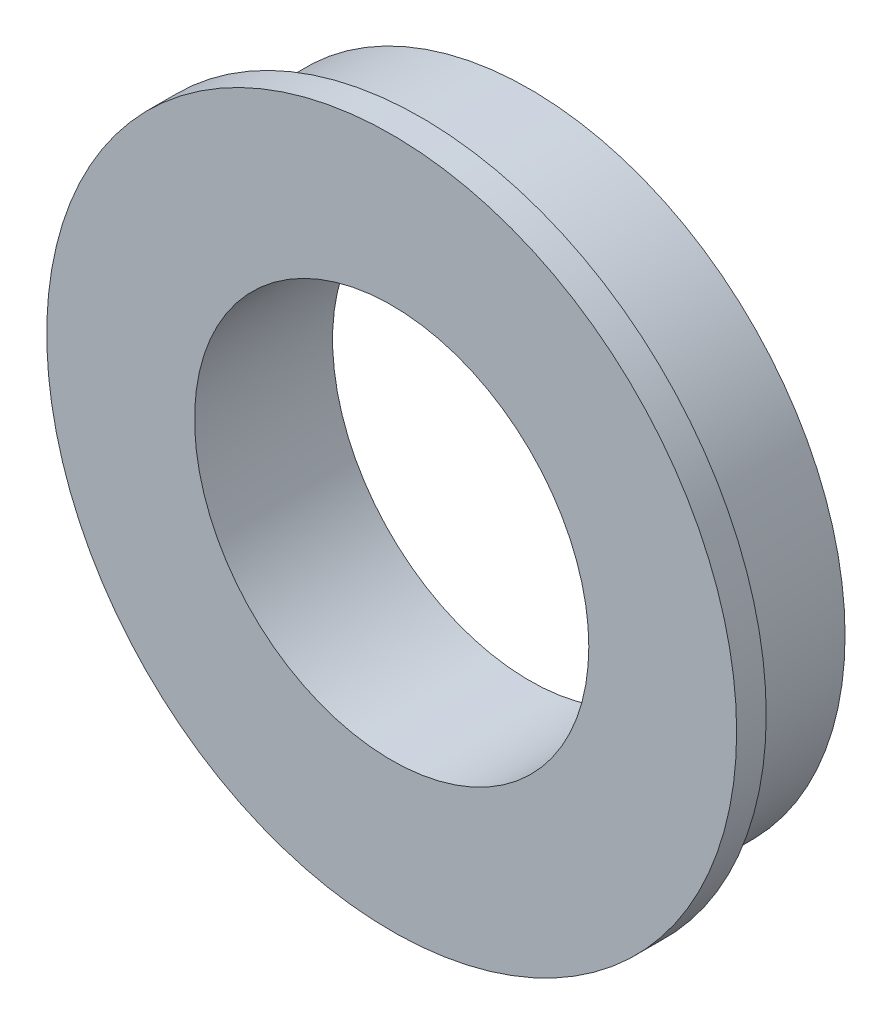
from build123d import *

# Parameters (mm, degrees)
SKETCH_1_R      = 16
SKETCH_1_R_2    = 10
EXTRUDE_1_DEPTH = 5.5
SKETCH_2_R      = 17.5
SKETCH_2_R_2    = 10
EXTRUDE_2_DEPTH = 1.5


with BuildPart() as part:
    # 草图1 → 凸台-拉伸1 (new body)
    with BuildSketch(Plane.XY):
        Circle(SKETCH_1_R)
        Circle(SKETCH_1_R_2, mode=Mode.SUBTRACT)
    extrude(amount=EXTRUDE_1_DEPTH)

    # 草图2 → 凸台-拉伸2 (add)
    with BuildSketch(Plane.XY.offset(5.5)):
        Circle(SKETCH_2_R)
        Circle(SKETCH_2_R_2, mode=Mode.SUBTRACT)
    extrude(amount=EXTRUDE_2_DEPTH)


solid = part.part
